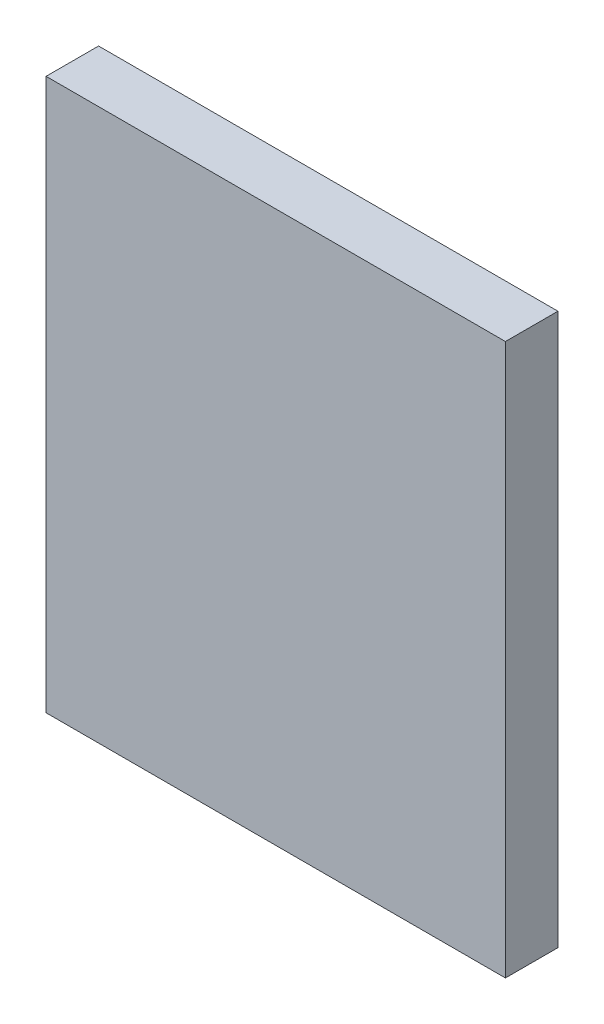
from build123d import *

# Parameters (mm, degrees)
CROQUIS1_W              = 35
CROQUIS1_H              = 42
SALIENTE_EXTRUIR1_DEPTH = 4


with BuildPart() as part:
    # Croquis1 → Saliente-Extruir1 (new body)
    with BuildSketch(Plane.XY):
        with Locations((17.5, -21)):
            Rectangle(CROQUIS1_W, CROQUIS1_H)
    extrude(amount=SALIENTE_EXTRUIR1_DEPTH)


solid = part.part
